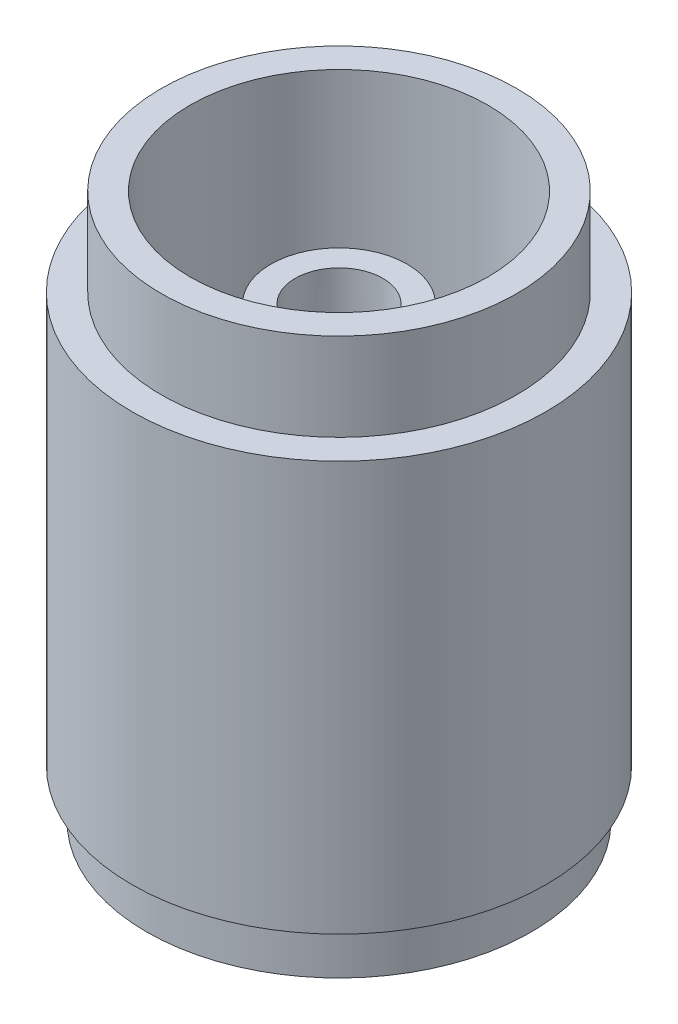
from build123d import *


with BuildPart() as part:
    # Sketch1 → Revolve-Thin2 (revolve)
    with BuildSketch(Plane.XY, mode=Mode.PRIVATE) as revolve_thin2_sk:
        Polygon((-30.568264707, -2), (-39.483227781, -2), (-39.483227781, 7.913824599), (-42.483227781, 7.913824599), (-42.483227781, 92), (-36.483227781, 92), (-36.483227781, 110), (-30.568264707, 110), (-30.568264707, 28.789318309), (-17.568264707, 21.050812692), (-17.568264707, 7.913824599), (-30.568264707, 7.913824599), align=None)
        Polygon((-32.568264707, 0), (-37.483227781, 0), (-37.483227781, 9.913824599), (-40.483227781, 9.913824599), (-40.483227781, 90), (-34.483227781, 90), (-34.483227781, 108), (-32.568264707, 108), (-32.568264707, 27.652330216), (-19.568264707, 19.913824599), (-19.568264707, 9.913824599), (-32.568264707, 9.913824599), align=None, mode=Mode.SUBTRACT)
    revolve(revolve_thin2_sk.sketch.rotate(Axis((0, 0, 0), (0, 1, 0)), 270), axis=Axis((0, 0, 0), (0, 1, 0)))


with BuildPart() as body_2:
    # Sketch2 → Revolve1 (revolve)
    with BuildSketch(Plane.XY, mode=Mode.PRIVATE) as revolve1_sk:
        Polygon((-8, 9.913824599), (-8, 19.5), (-14.206561831, 24.739637185), (-14, 90), (-9.000025046, 89.9841741), (-9.19920546, 27.055868252), (-3, 21.822441383), (-3, 9.913824599), align=None)
    revolve(revolve1_sk.sketch.rotate(Axis((0, 0, 0), (0, 1, 0)), 270), axis=Axis((0, 0, 0), (0, 1, 0)))


with BuildPart() as part_1:
    add(part.part)

    add(body_2.part)  # Revolve4 merges body 2
    # Sketch3 → Revolve4 (revolve)
    with BuildSketch(Plane.XY, mode=Mode.PRIVATE) as revolve4_sk:
        Polygon((-21.027014256, 57.038111316), (-21.027014256, 50.338132018), (-27.983227781, 50.338132018), (-32.562811664, 50.338132018), (-32.562811664, 44.614788696), (0, 44.614788696), (0, 62.838111316), (-27.983227781, 62.838111316), (-32.562811664, 62.838111316), (-32.562811664, 57.038111316), align=None)
    revolve(revolve4_sk.sketch.rotate(Axis((0, 0, 0), (0, 1, 0)), 270), axis=Axis((0, 0, 0), (0, 1, 0)))


solid = part_1.part
